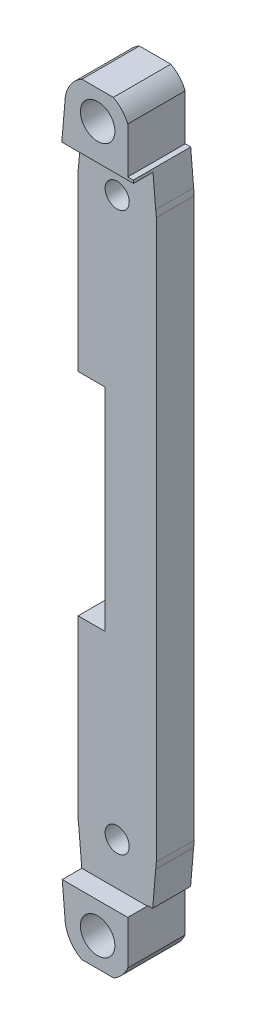
from build123d import *

# Parameters (mm, degrees)
SKIZZE5_R                       = 2.85
AUFSATZ_LINEAR_AUSTRAGEN2_DEPTH = 5
SKIZZE7_R                       = 1.5
SKIZZE7_R_2                     = 2.5
SCHNITT_LINEAR_AUSTRAGEN1_DEPTH = 5
SKIZZE10_R                      = 3.4
AUFSATZ_LINEAR_AUSTRAGEN4_DEPTH = 5
SKIZZE11_R                      = 1.05
SCHNITT_LINEAR_AUSTRAGEN3_DEPTH = 5
SKIZZE15_R                      = 2.25
SCHNITT_LINEAR_AUSTRAGEN7_DEPTH = 2
SKIZZE16_W                      = 8.368883353
SKIZZE16_H                      = 55.536319394
SCHNITT_LINEAR_AUSTRAGEN8_DEPTH = 1.7
SKIZZE17_W                      = 2.331134025
SKIZZE17_H                      = 18.40252581
SKIZZE17_W_2                    = 6.80460091
SKIZZE17_H_2                    = 1.708942227
SKIZZE17_W_3                    = 9.007409032
SKIZZE17_H_3                    = 2.575965086
SKIZZE17_W_4                    = 1.92022312
SKIZZE17_H_4                    = 5.063487197
SKIZZE17_H_5                    = 4.286912164
SCHNITT_LINEAR_AUSTRAGEN9_DEPTH = 11.7


with BuildPart() as part:
    # Skizze5 → Aufsatz-Linear austragen2 (new body)
    with BuildSketch(Plane.XY):
        with BuildLine():
            Line((-40.726132402, -24.649552882), (-40.726132402, 23.890447118))
            ThreePointArc((-40.726132402, 23.890447118), (-44.126132402, 20.490447118), (-47.526132402, 23.890447118))
            Line((-47.526132402, 23.890447118), (-47.526132402, -24.649552882))
            ThreePointArc((-47.526132402, -24.649552882), (-44.126132402, -21.249552882), (-40.726132402, -24.649552882))
        make_face()
        with BuildLine():
            Line((-40.726132402, 23.890447118), (-40.775983963, 24.470537999))
            ThreePointArc((-40.775983963, 24.470537999), (-44.126132402, 27.290447118), (-47.476280842, 24.470537999))
            Line((-47.476280842, 24.470537999), (-47.526132402, 23.890447118))
            ThreePointArc((-47.526132402, 23.890447118), (-44.126132402, 20.490447118), (-40.726132402, 23.890447118))
        make_face()
        with Locations((-44.126132402, 30.290447118)):
            Circle(SKIZZE5_R)
        with BuildLine():
            Line((-40.775983963, 24.470537999), (-41.276132402, 30.290447118))
            ThreePointArc((-41.276132402, 30.290447118), (-44.126132402, 27.440447118), (-46.976132402, 30.290447118))
            Line((-46.976132402, 30.290447118), (-47.476280842, 24.470537999))
            ThreePointArc((-47.476280842, 24.470537999), (-44.126132402, 27.290447118), (-40.775983963, 24.470537999))
        make_face()
        with BuildLine():
            Line((-40.775983963, -25.229643764), (-40.726132402, -24.649552882))
            ThreePointArc((-40.726132402, -24.649552882), (-44.126132402, -21.249552882), (-47.526132402, -24.649552882))
            Line((-47.526132402, -24.649552882), (-47.476280842, -25.229643764))
            ThreePointArc((-47.476280842, -25.229643764), (-44.126132402, -28.049552882), (-40.775983963, -25.229643764))
        make_face()
        with BuildLine():
            Line((-41.276132402, -31.049552882), (-40.775983963, -25.229643764))
            ThreePointArc((-40.775983963, -25.229643764), (-44.126132402, -28.049552882), (-47.476280842, -25.229643764))
            Line((-47.476280842, -25.229643764), (-46.976132402, -31.049552882))
            ThreePointArc((-46.976132402, -31.049552882), (-44.126132402, -28.199552882), (-41.276132402, -31.049552882))
        make_face()
        with Locations((-44.126132402, -31.049552882)):
            Circle(SKIZZE5_R)
    extrude(amount=AUFSATZ_LINEAR_AUSTRAGEN2_DEPTH)

    # Skizze7 → Schnitt-Linear austragen1 (cut)
    with BuildSketch(Plane(origin=(0, 0, 0), x_dir=(-1, 0, 0), z_dir=(0, 0, -1))):
        with Locations((44.126132402, 30.290447118)):
            Circle(SKIZZE7_R)
        with Locations((44.126132402, 23.890447118)):
            Circle(SKIZZE7_R_2)
        with Locations((44.126132402, -24.649552882)):
            Circle(SKIZZE7_R_2)
        with Locations((44.126132402, -31.049552882)):
            Circle(SKIZZE7_R)
    extrude(amount=-SCHNITT_LINEAR_AUSTRAGEN1_DEPTH, mode=Mode.SUBTRACT)

    # Skizze10 → Aufsatz-Linear austragen4 (add)
    with BuildSketch(Plane(origin=(0, 0, 0), x_dir=(-1, 0, 0), z_dir=(0, 0, -1))):
        with Locations((44.126132402, 23.890447118)):
            Circle(SKIZZE10_R)
        with Locations((44.126132402, -24.649552882)):
            Circle(SKIZZE10_R)
    extrude(amount=-AUFSATZ_LINEAR_AUSTRAGEN4_DEPTH)

    # Skizze11 → Schnitt-Linear austragen3 (cut)
    with BuildSketch(Plane(origin=(0, 0, 0), x_dir=(-1, 0, 0), z_dir=(0, 0, -1))):
        with Locations((44.126132402, -24.649552882)):
            Circle(SKIZZE11_R)
        with Locations((44.126132402, 23.890447118)):
            Circle(SKIZZE11_R)
    extrude(amount=-SCHNITT_LINEAR_AUSTRAGEN3_DEPTH, mode=Mode.SUBTRACT)

    # Skizze15 → Schnitt-Linear austragen7 (cut)
    with BuildSketch(Plane(origin=(0, 0, 0), x_dir=(-1, 0, 0), z_dir=(0, 0, -1))):
        with Locations((44.126132402, 30.290447118)):
            Circle(SKIZZE15_R)
        with Locations((44.126132402, -31.049552882)):
            Circle(SKIZZE15_R)
    extrude(amount=-SCHNITT_LINEAR_AUSTRAGEN7_DEPTH, mode=Mode.SUBTRACT)

    # Skizze16 → Schnitt-Linear austragen8 (cut)
    with BuildSketch(Plane.XY.offset(5)):
        with Locations((-44.250355177, -0.588324363)):
            Rectangle(SKIZZE16_W, SKIZZE16_H)
    extrude(amount=-SCHNITT_LINEAR_AUSTRAGEN8_DEPTH, mode=Mode.SUBTRACT)

    # Skizze17 → Schnitt-Linear austragen9 (cut)
    with BuildSketch(Plane(origin=(0, 0, 0), x_dir=(-1, 0, 0), z_dir=(0, 0, -1))):
        with Locations((46.36056539, -0.295648179)):
            Rectangle(SKIZZE17_W, SKIZZE17_H)
        with Locations((44.482182567, 33.645654459)):
            Rectangle(SKIZZE17_W_2, SKIZZE17_H_2)
        with Locations((44.254699543, -34.820369049)):
            Rectangle(SKIZZE17_W_3, SKIZZE17_H_3)
        with Locations((40.545518977, 29.95066177)):
            Rectangle(SKIZZE17_W_4, SKIZZE17_H_4)
        with Locations((40.545518977, -30.43359055)):
            Rectangle(SKIZZE17_W_4, SKIZZE17_H_5)
    extrude(amount=-SCHNITT_LINEAR_AUSTRAGEN9_DEPTH, mode=Mode.SUBTRACT)


solid = part.part
